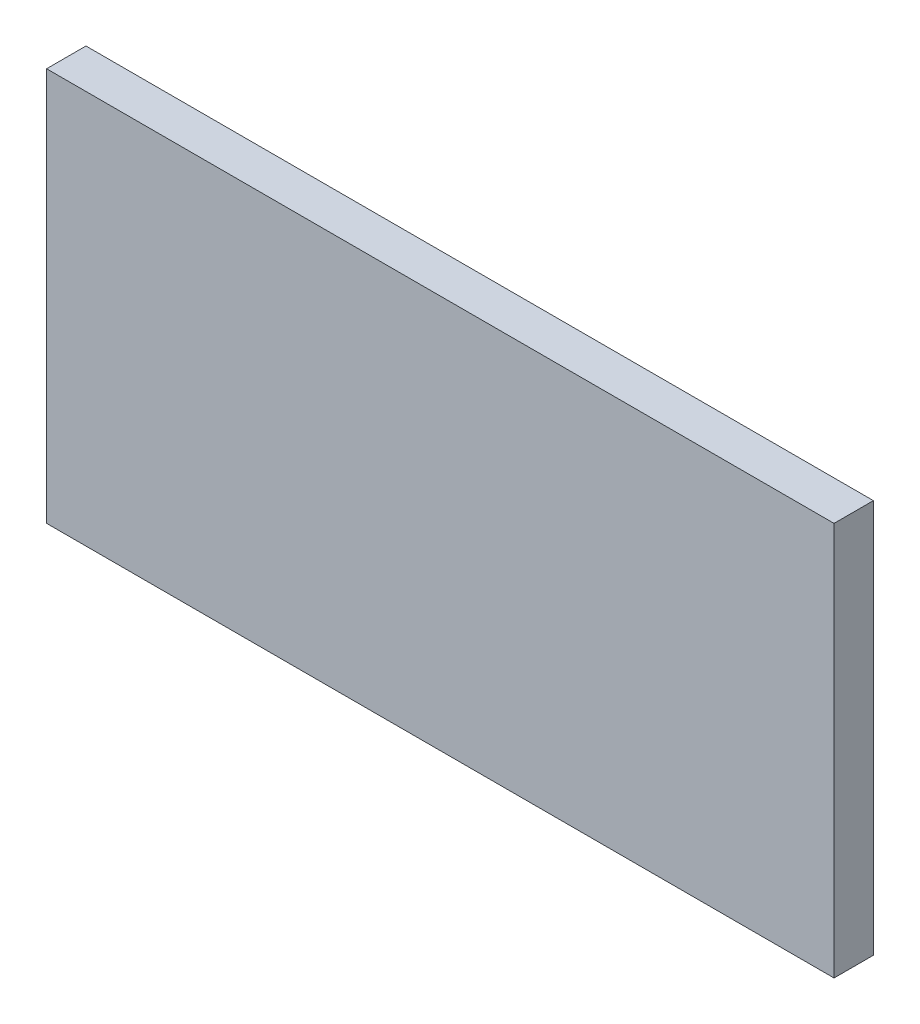
from build123d import *

# Parameters (mm, degrees)
ESQUISSE1_W        = 2000
ESQUISSE1_H        = 1000
BOSS_EXTRU_1_DEPTH = 100


with BuildPart() as part:
    # Esquisse1 → Boss.-Extru.1 (new body)
    with BuildSketch(Plane.XY):
        with Locations((1000, 500)):
            Rectangle(ESQUISSE1_W, ESQUISSE1_H)
    extrude(amount=BOSS_EXTRU_1_DEPTH)


solid = part.part
